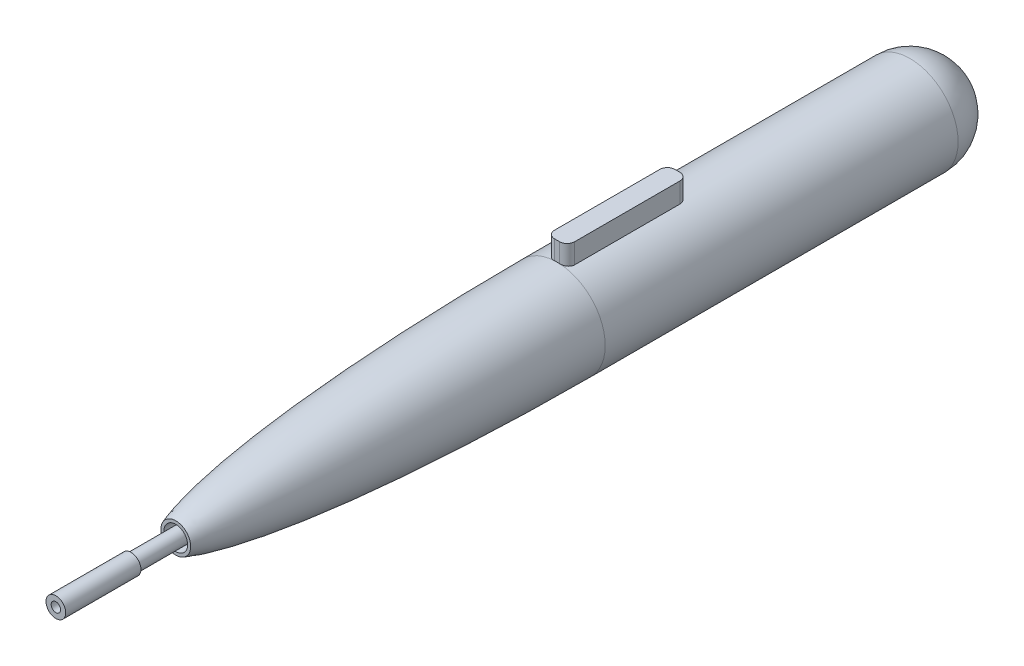
from build123d import *

# Parameters (mm, degrees)
SKETCH2_R           = 30
CUT_EXTRUDE1_DEPTH  = 1031.526551259
SKETCH3_R           = 25
BOSS_EXTRUDE1_DEPTH = 1270
SKETCH4_R           = 12
CUT_EXTRUDE2_DEPTH  = 1103.63
CUT_EXTRUDE3_START  = -1016
SKETCH5_R           = 25
SKETCH5_R_2         = 20
CUT_EXTRUDE3_DEPTH  = 1016
BOSS_EXTRUDE2_DEPTH = 304.8
FILLET1_R           = 19.05


with BuildPart() as part:
    # Sketch1 → Revolve1 (revolve)
    with BuildSketch(Plane(origin=(0, 0, 0), x_dir=(0, 0, -1), z_dir=(1, 0, 0)), mode=Mode.PRIVATE) as revolve1_sk:
        with BuildLine():
            Line((-966.206657789, 37.7), (-966.206657789, 25))
            Line((-966.206657789, 25), (0, 25))
            Line((0, 25), (0, 0))
            Line((0, 0), (1016, 0))
            ThreePointArc((1016, 0), (980.290458762, 86.210458762), (894.08, 121.92))
            Line((894.08, 121.92), (0, 121.92))
            add(Edge.make_bspline(
                [(0, 121.92), (-738.002228528, 121.92), (-966.206657789, 37.7)],
                knots=[1.570796327, 1.570796327, 1.570796327, 2.827220811, 2.827220811, 2.827220811], degree=2, weights=[1, 0.809079465, 1]))
        make_face()
    revolve(revolve1_sk.sketch.rotate(Axis((0, 0, 0), (0, 0, -1)), 90), axis=Axis((0, 0, 0), (0, 0, -1)))

    # Sketch2 → Cut-Extrude1 (cut, through all)
    with BuildSketch(Plane.XY):
        with Locations(Location((0, 0, 0), (0, 0, 180))):
            Circle(SKETCH2_R)
    extrude(amount=CUT_EXTRUDE1_DEPTH, mode=Mode.SUBTRACT)

    # Sketch3 → Boss-Extrude1 (add)
    with BuildSketch(Plane.XY):
        with Locations(Location((0, 0, 0), (0, 0, 180))):
            Circle(SKETCH3_R)
    extrude(amount=BOSS_EXTRUDE1_DEPTH)

    # Sketch4 → Cut-Extrude2 (cut)
    with BuildSketch(Plane.XY.offset(1270)):
        Circle(SKETCH4_R)
    extrude(amount=-CUT_EXTRUDE2_DEPTH, mode=Mode.SUBTRACT)

    # Sketch5 → Cut-Extrude3 (cut)
    with BuildSketch(Plane.XY.offset(1079.5).offset(CUT_EXTRUDE3_START)):
        with Locations(Location((0, 0, 0), (0, 0, 180))):
            Circle(SKETCH5_R)
        Circle(SKETCH5_R_2, mode=Mode.SUBTRACT)
    extrude(amount=CUT_EXTRUDE3_DEPTH, mode=Mode.SUBTRACT)

    # Sketch6 → Boss-Extrude2 (add)
    with BuildSketch(Plane.XY):
        with BuildLine():
            Line((-25.4, 170.044817078), (25.4, 170.044817078))
            Line((25.4, 170.044817078), (25.4, 119.244817078))
            ThreePointArc((25.4, 119.244817078), (0, 121.92), (-25.4, 119.244817078))
            Line((-25.4, 119.244817078), (-25.4, 170.044817078))
        make_face()
    extrude(amount=-BOSS_EXTRUDE2_DEPTH)

    # Fillet1
    fillet1_edges = [part.edges().sort_by_distance(p)[0] for p in [
        (-25.4, 144.644817078, -304.8),
        (25.4, 144.644817078, -304.8),
        (-25.4, 144.644817078, 0),
        (25.4, 144.644817078, 0),
    ]]
    fillet(fillet1_edges, radius=FILLET1_R)


solid = part.part
